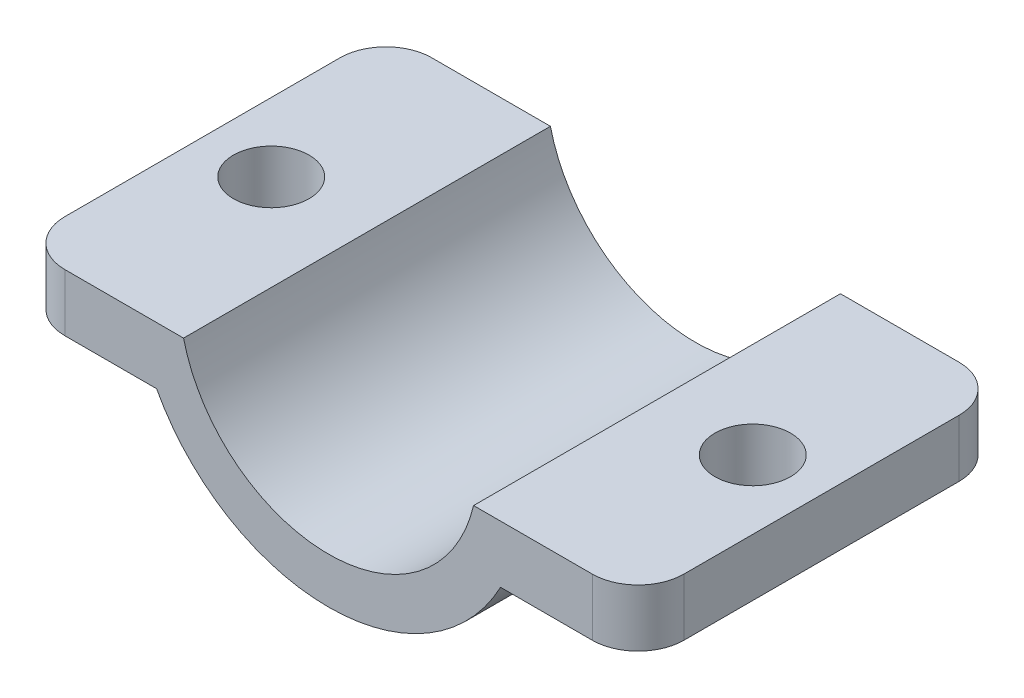
from build123d import *

# Parameters (mm, degrees)
EXTRUDE_1_DEPTH     = 16
SKETCH_2_R          = 1.65
CUT_EXTRUDE_1_DEPTH = 22.412613105
FILLET_1_R          = 2


with BuildPart() as part:
    # 草图1 → 凸台-拉伸1 (new body)
    with BuildSketch(Plane.XY):
        with BuildLine():
            Line((-6.32455532, -1.5), (-13.5, -1.5))
            Line((-13.5, -1.5), (-13.5, -4))
            Line((-13.5, -4), (-7.5, -4))
            ThreePointArc((-7.5, -4), (0, -8.5), (7.5, -4))
            Line((7.5, -4), (13.5, -4))
            Line((13.5, -4), (13.5, -1.5))
            Line((13.5, -1.5), (6.32455532, -1.5))
            ThreePointArc((6.32455532, -1.5), (0, -6.5), (-6.32455532, -1.5))
        make_face()
    extrude(amount=EXTRUDE_1_DEPTH)

    # 草图2 → 切除-拉伸1 (cut, through all)
    with BuildSketch(Plane.XZ.offset(4)):
        with Locations(Location((-10.5, 8, 0), (0, 0, 270))):
            Circle(SKETCH_2_R)
        with Locations(Location((10.5, 8, 0), (0, 0, 270))):
            Circle(SKETCH_2_R)
    extrude(amount=-CUT_EXTRUDE_1_DEPTH, mode=Mode.SUBTRACT)

    # 圆角1
    fillet_1_edges = [part.edges().sort_by_distance(p)[0] for p in [
        (-13.5, -2.75, 16),
        (13.5, -2.75, 16),
        (13.5, -2.75, 0),
        (-13.5, -2.75, 0),
    ]]
    fillet(fillet_1_edges, radius=FILLET_1_R)


solid = part.part
